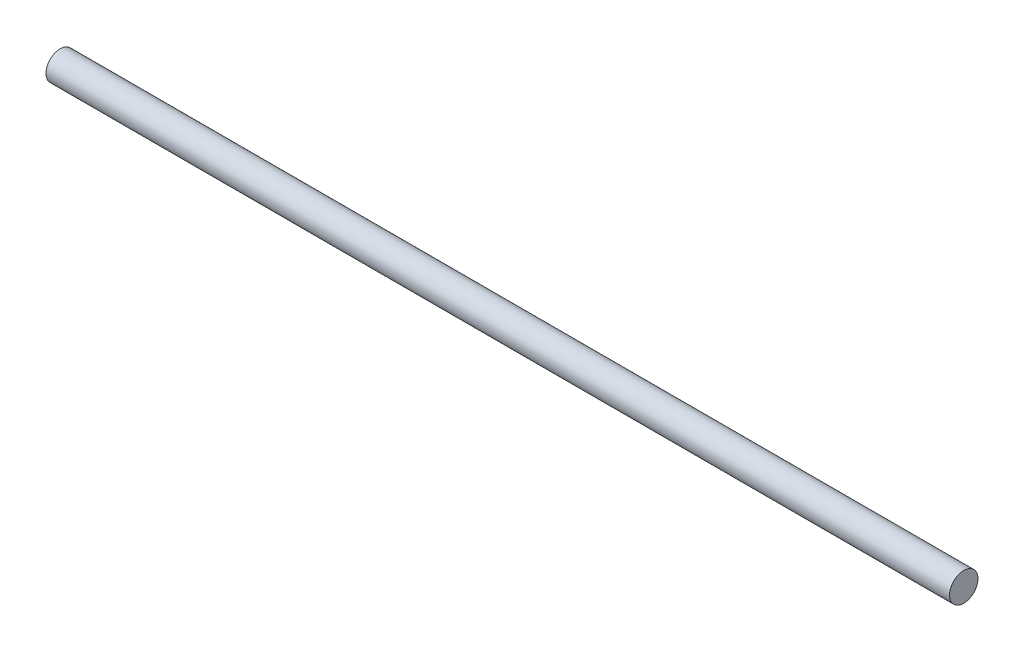
from build123d import *

# Parameters (mm, degrees)
SKETCH1_R           = 4.0005
BOSS_EXTRUDE1_DEPTH = 254


with BuildPart() as part:
    # Sketch1 → Boss-Extrude1 (new body)
    with BuildSketch(Plane(origin=(0, 0, 0), x_dir=(0, 0, -1), z_dir=(1, 0, 0))):
        Circle(SKETCH1_R)
    extrude(amount=BOSS_EXTRUDE1_DEPTH)


solid = part.part
